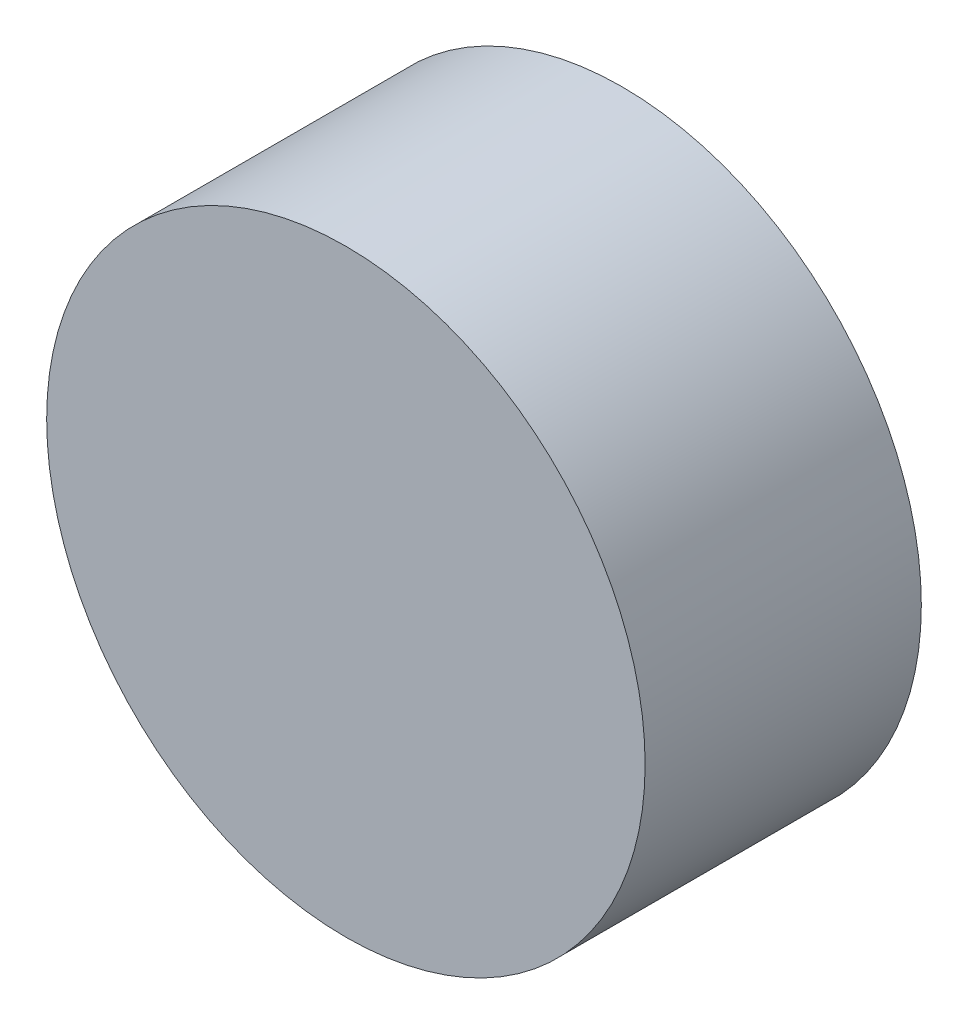
from build123d import *

# Parameters (mm, degrees)
SKETCH_1_R      = 3.25
EXTRUDE_1_DEPTH = 3


with BuildPart() as part:
    # 草图1 → 凸台-拉伸1 (new body)
    with BuildSketch(Plane.XY):
        Circle(SKETCH_1_R)
    extrude(amount=EXTRUDE_1_DEPTH)


solid = part.part
